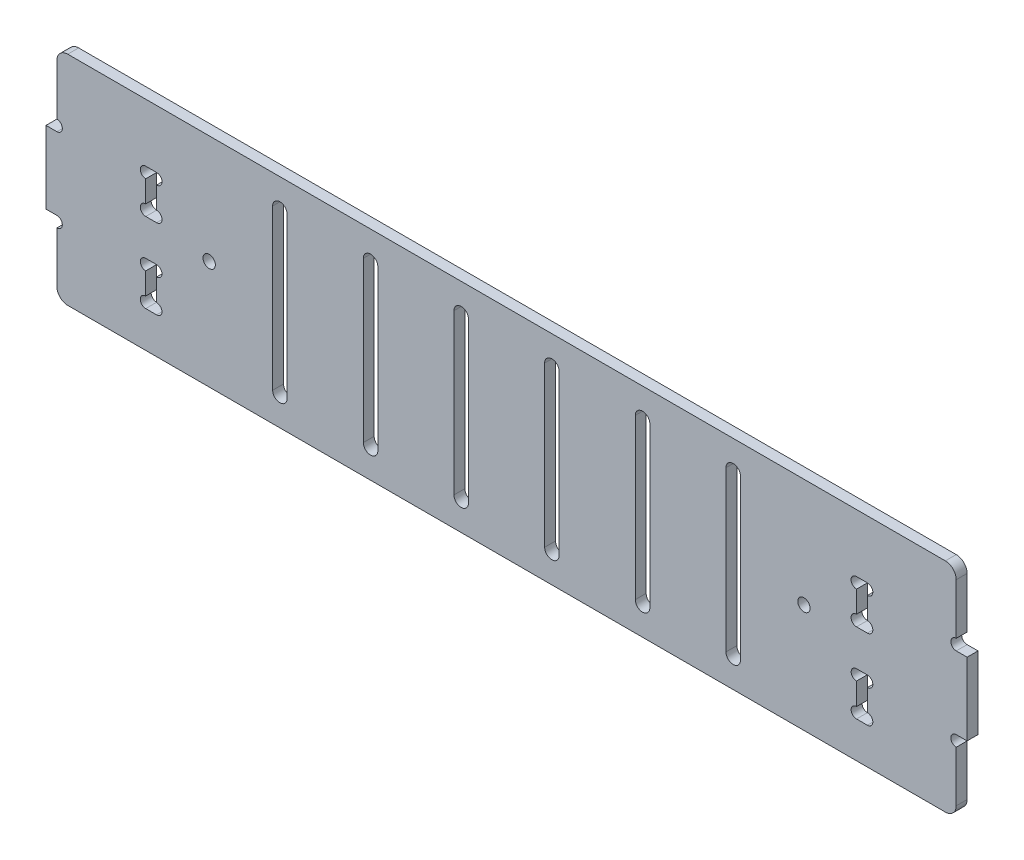
from build123d import *

# Parameters (mm, degrees)
SKETCH_1_W          = 254
SKETCH_1_H          = 55
EXTRUDE_1_DEPTH     = 3
SKETCH_2_W          = 3
SKETCH_2_H          = 20
SKETCH_2_H_2        = 15
CUT_EXTRUDE_1_DEPTH = 130.977882734
SKETCH_3_W          = 3
SKETCH_3_H          = 12
CUT_EXTRUDE_2_DEPTH = 130.977882734
CUT_EXTRUDE_3_DEPTH = 130.977882734
SKETCH_5_R          = 1.5
CUT_EXTRUDE_4_DEPTH = 130.977882734
SKETCH_6_R          = 1.7
CUT_EXTRUDE_5_DEPTH = 130.977882734
SKETCH_7_W          = 248
SKETCH_7_H          = 3
EXTRUDE_2_DEPTH     = 5
CUT_EXTRUDE_6_DEPTH = 132.126846984
FILLET_1_R          = 3


with BuildPart() as part:
    # 草图1 → 凸台-拉伸1 (new body)
    with BuildSketch(Plane.XY):
        Rectangle(SKETCH_1_W, SKETCH_1_H)
    extrude(amount=EXTRUDE_1_DEPTH)

    # 草图2 → 切除-拉伸1 (cut, through all)
    with BuildSketch(Plane.XY.offset(3)):
        with Locations((-125.5, -17.5)):
            Rectangle(SKETCH_2_W, SKETCH_2_H)
        with Locations((-125.5, 20)):
            Rectangle(SKETCH_2_W, SKETCH_2_H_2)
        with Locations((125.5, -17.5)):
            Rectangle(SKETCH_2_W, SKETCH_2_H)
        with Locations((125.5, 20)):
            Rectangle(SKETCH_2_W, SKETCH_2_H_2)
    extrude(amount=-CUT_EXTRUDE_1_DEPTH, mode=Mode.SUBTRACT)

    # 草图3 → 切除-拉伸2 (cut, through all)
    with BuildSketch(Plane.XY.offset(3)):
        with Locations((-98, -11.5)):
            Rectangle(SKETCH_3_W, SKETCH_3_H)
        with Locations((-98, 10.5)):
            Rectangle(SKETCH_3_W, SKETCH_3_H)
        with Locations((98, -11.5)):
            Rectangle(SKETCH_3_W, SKETCH_3_H)
        with Locations((98, 10.5)):
            Rectangle(SKETCH_3_W, SKETCH_3_H)
    extrude(amount=-CUT_EXTRUDE_2_DEPTH, mode=Mode.SUBTRACT)

    # 草图4 → 切除-拉伸3 (cut, through all)
    with BuildSketch(Plane.XY.offset(3)):
        with BuildLine():
            Line((99.5, -14.5), (99.5, -17.5))
            ThreePointArc((99.5, -17.5), (100.560660172, -17.060660172), (101, -16))
            ThreePointArc((101, -16), (100.560660172, -14.939339828), (99.5, -14.5))
        make_face()
        with BuildLine():
            ThreePointArc((99.5, -14.5), (98, -16), (99.5, -17.5))
            Line((99.5, -17.5), (99.5, -14.5))
        make_face()
        with BuildLine():
            Line((96.5, -14.55), (96.5, -17.5))
            ThreePointArc((96.5, -17.5), (97.542982502, -17.067982502), (97.975, -16.025))
            ThreePointArc((97.975, -16.025), (97.542982502, -14.982017498), (96.5, -14.55))
        make_face()
        with BuildLine():
            ThreePointArc((96.5, -14.55), (95.025, -16.025), (96.5, -17.5))
            Line((96.5, -17.5), (96.5, -14.55))
        make_face()
        with BuildLine():
            ThreePointArc((96.5, -5.5), (95.025, -6.975), (96.5, -8.45))
            Line((96.5, -8.45), (96.5, -5.5))
        make_face()
        with BuildLine():
            Line((96.5, -5.5), (96.5, -8.45))
            ThreePointArc((96.5, -8.45), (97.542982502, -8.017982502), (97.975, -6.975))
            ThreePointArc((97.975, -6.975), (97.542982502, -5.932017498), (96.5, -5.5))
        make_face()
        with BuildLine():
            ThreePointArc((99.5, -5.5), (98, -7), (99.5, -8.5))
            Line((99.5, -8.5), (99.5, -5.5))
        make_face()
        with BuildLine():
            Line((99.5, -5.5), (99.5, -8.5))
            ThreePointArc((99.5, -8.5), (100.560660172, -8.060660172), (101, -7))
            ThreePointArc((101, -7), (100.560660172, -5.939339828), (99.5, -5.5))
        make_face()
        with BuildLine():
            ThreePointArc((99.5, 7.5), (98.439339828, 7.060660172), (98, 6))
            ThreePointArc((98, 6), (98.439339828, 4.939339828), (99.5, 4.5))
            Line((99.5, 4.5), (99.5, 7.5))
        make_face()
        with BuildLine():
            Line((99.5, 7.5), (99.5, 4.5))
            ThreePointArc((99.5, 4.5), (100.560660172, 4.939339828), (101, 6))
            ThreePointArc((101, 6), (100.560660172, 7.060660172), (99.5, 7.5))
        make_face()
        with BuildLine():
            Line((96.5, 7.5), (96.5, 4.5))
            ThreePointArc((96.5, 4.5), (97.560660172, 4.939339828), (98, 6))
            ThreePointArc((98, 6), (97.560660172, 7.060660172), (96.5, 7.5))
        make_face()
        with BuildLine():
            ThreePointArc((96.5, 7.5), (95, 6), (96.5, 4.5))
            Line((96.5, 4.5), (96.5, 7.5))
        make_face()
        with BuildLine():
            Line((96.5, 16.5), (96.5, 13.5))
            ThreePointArc((96.5, 13.5), (97.560660172, 13.939339828), (98, 15))
            ThreePointArc((98, 15), (97.560660172, 16.060660172), (96.5, 16.5))
        make_face()
        with BuildLine():
            ThreePointArc((96.5, 16.5), (95, 15), (96.5, 13.5))
            Line((96.5, 13.5), (96.5, 16.5))
        make_face()
        with BuildLine():
            Line((99.5, 16.5), (99.5, 13.5))
            ThreePointArc((99.5, 13.5), (100.560660172, 13.939339828), (101, 15))
            ThreePointArc((101, 15), (100.560660172, 16.060660172), (99.5, 16.5))
        make_face()
        with BuildLine():
            ThreePointArc((98, 15), (98.439339828, 13.939339828), (99.5, 13.5))
            Line((99.5, 13.5), (99.5, 16.5))
            ThreePointArc((99.5, 16.5), (98.439339828, 16.060660172), (98, 15))
        make_face()
        with BuildLine():
            ThreePointArc((-96.5, 13.5), (-95.439339828, 13.939339828), (-95, 15))
            ThreePointArc((-95, 15), (-95.439339828, 16.060660172), (-96.5, 16.5))
            Line((-96.5, 16.5), (-96.5, 13.5))
        make_face()
        with BuildLine():
            Line((-96.5, 13.5), (-96.5, 16.5))
            ThreePointArc((-96.5, 16.5), (-97.560660172, 16.060660172), (-98, 15))
            ThreePointArc((-98, 15), (-97.560660172, 13.939339828), (-96.5, 13.5))
        make_face()
        with BuildLine():
            ThreePointArc((-99.5, 13.5), (-98.439339828, 13.939339828), (-98, 15))
            ThreePointArc((-98, 15), (-98.439339828, 16.060660172), (-99.5, 16.5))
            Line((-99.5, 16.5), (-99.5, 13.5))
        make_face()
        with BuildLine():
            Line((-99.5, 13.5), (-99.5, 16.5))
            ThreePointArc((-99.5, 16.5), (-101, 15), (-99.5, 13.5))
        make_face()
        with BuildLine():
            ThreePointArc((-99.5, 4.5), (-98.439339828, 4.939339828), (-98, 6))
            ThreePointArc((-98, 6), (-98.439339828, 7.060660172), (-99.5, 7.5))
            Line((-99.5, 7.5), (-99.5, 4.5))
        make_face()
        with BuildLine():
            Line((-99.5, 4.5), (-99.5, 7.5))
            ThreePointArc((-99.5, 7.5), (-101, 6), (-99.5, 4.5))
        make_face()
        with BuildLine():
            Line((-96.5, 4.5), (-96.5, 7.5))
            ThreePointArc((-96.5, 7.5), (-97.560660172, 7.060660172), (-98, 6))
            ThreePointArc((-98, 6), (-97.560660172, 4.939339828), (-96.5, 4.5))
        make_face()
        with BuildLine():
            ThreePointArc((-95, 6), (-95.439339828, 7.060660172), (-96.5, 7.5))
            Line((-96.5, 7.5), (-96.5, 4.5))
            ThreePointArc((-96.5, 4.5), (-95.439339828, 4.939339828), (-95, 6))
        make_face()
        with BuildLine():
            ThreePointArc((-96.5, -8.45), (-95.457017498, -8.017982502), (-95.025, -6.975))
            ThreePointArc((-95.025, -6.975), (-95.457017498, -5.932017498), (-96.5, -5.5))
            Line((-96.5, -5.5), (-96.5, -8.45))
        make_face()
        with BuildLine():
            Line((-96.5, -8.45), (-96.5, -5.5))
            ThreePointArc((-96.5, -5.5), (-97.975, -6.975), (-96.5, -8.45))
        make_face()
        with BuildLine():
            ThreePointArc((-99.5, -8.5), (-98.439339828, -8.060660172), (-98, -7))
            ThreePointArc((-98, -7), (-98.439339828, -5.939339828), (-99.5, -5.5))
            Line((-99.5, -5.5), (-99.5, -8.5))
        make_face()
        with BuildLine():
            Line((-99.5, -8.5), (-99.5, -5.5))
            ThreePointArc((-99.5, -5.5), (-101, -7), (-99.5, -8.5))
        make_face()
        with BuildLine():
            ThreePointArc((-98, -16), (-98.439339828, -14.939339828), (-99.5, -14.5))
            Line((-99.5, -14.5), (-99.5, -17.5))
            ThreePointArc((-99.5, -17.5), (-98.439339828, -17.060660172), (-98, -16))
        make_face()
        with BuildLine():
            Line((-99.5, -17.5), (-99.5, -14.5))
            ThreePointArc((-99.5, -14.5), (-101, -16), (-99.5, -17.5))
        make_face()
        with BuildLine():
            ThreePointArc((-95.025, -16.025), (-95.457017498, -14.982017498), (-96.5, -14.55))
            Line((-96.5, -14.55), (-96.5, -17.5))
            ThreePointArc((-96.5, -17.5), (-95.457017498, -17.067982502), (-95.025, -16.025))
        make_face()
        with BuildLine():
            Line((-96.5, -17.5), (-96.5, -14.55))
            ThreePointArc((-96.5, -14.55), (-97.975, -16.025), (-96.5, -17.5))
        make_face()
    extrude(amount=-CUT_EXTRUDE_3_DEPTH, mode=Mode.SUBTRACT)

    # 草图5 → 切除-拉伸4 (cut, through all)
    with BuildSketch(Plane.XY.offset(3)):
        with Locations((-124, 14)):
            Circle(SKETCH_5_R)
        with Locations((-124, -9)):
            Circle(SKETCH_5_R)
        with Locations((124, -9)):
            Circle(SKETCH_5_R)
        with Locations((124, 14)):
            Circle(SKETCH_5_R)
    extrude(amount=-CUT_EXTRUDE_4_DEPTH, mode=Mode.SUBTRACT)

    # 草图6 → 切除-拉伸5 (cut, through all)
    with BuildSketch(Plane.XY.offset(3)):
        with Locations((-82, 2.5)):
            Circle(SKETCH_6_R)
        with Locations(Location((82, 2.5, 0), (0, 0, 180))):
            Circle(SKETCH_6_R)
    extrude(amount=-CUT_EXTRUDE_5_DEPTH, mode=Mode.SUBTRACT)

    # 草图7 → 凸台-拉伸2 (add)
    with BuildSketch(Plane(origin=(0, 27.5, 0), x_dir=(1, 0, 0), z_dir=(0, 1, 0))):
        with Locations((0, -1.5)):
            Rectangle(SKETCH_7_W, SKETCH_7_H)
    extrude(amount=EXTRUDE_2_DEPTH)

    # 草图8 → 切除-拉伸6 (cut, through all)
    with BuildSketch(Plane.XY.offset(3)):
        with BuildLine():
            Line((-60.5, 24.5), (-60.5, -19.5))
            ThreePointArc((-60.5, -19.5), (-62.5, -21.5), (-64.5, -19.5))
            Line((-64.5, -19.5), (-64.5, 24.5))
            ThreePointArc((-64.5, 24.5), (-62.5, 26.5), (-60.5, 24.5))
        make_face()
        with BuildLine():
            Line((-39.5, 24.5), (-39.5, -19.5))
            ThreePointArc((-39.5, -19.5), (-37.5, -21.5), (-35.5, -19.5))
            Line((-35.5, -19.5), (-35.5, 24.5))
            ThreePointArc((-35.5, 24.5), (-37.5, 26.5), (-39.5, 24.5))
        make_face()
        with BuildLine():
            Line((-14.5, 24.5), (-14.5, -19.5))
            ThreePointArc((-14.5, -19.5), (-12.5, -21.5), (-10.5, -19.5))
            Line((-10.5, -19.5), (-10.5, 24.5))
            ThreePointArc((-10.5, 24.5), (-12.5, 26.5), (-14.5, 24.5))
        make_face()
        with BuildLine():
            Line((60.5, 24.5), (60.5, -19.5))
            ThreePointArc((60.5, -19.5), (62.5, -21.5), (64.5, -19.5))
            Line((64.5, -19.5), (64.5, 24.5))
            ThreePointArc((64.5, 24.5), (62.5, 26.5), (60.5, 24.5))
        make_face()
        with BuildLine():
            Line((35.5, 24.5), (35.5, -19.5))
            ThreePointArc((35.5, -19.5), (37.5, -21.5), (39.5, -19.5))
            Line((39.5, -19.5), (39.5, 24.5))
            ThreePointArc((39.5, 24.5), (37.5, 26.5), (35.5, 24.5))
        make_face()
        with BuildLine():
            Line((10.5, 24.5), (10.5, -19.5))
            ThreePointArc((10.5, -19.5), (12.5, -21.5), (14.5, -19.5))
            Line((14.5, -19.5), (14.5, 24.5))
            ThreePointArc((14.5, 24.5), (12.5, 26.5), (10.5, 24.5))
        make_face()
    extrude(amount=-CUT_EXTRUDE_6_DEPTH, mode=Mode.SUBTRACT)

    # 圆角1
    fillet_1_edges = [part.edges().sort_by_distance(p)[0] for p in [
        (124, 32.5, 1.5),
        (-124, 32.5, 1.5),
        (124, -27.5, 1.5),
        (-124, -27.5, 1.5),
    ]]
    fillet(fillet_1_edges, radius=FILLET_1_R)


solid = part.part
